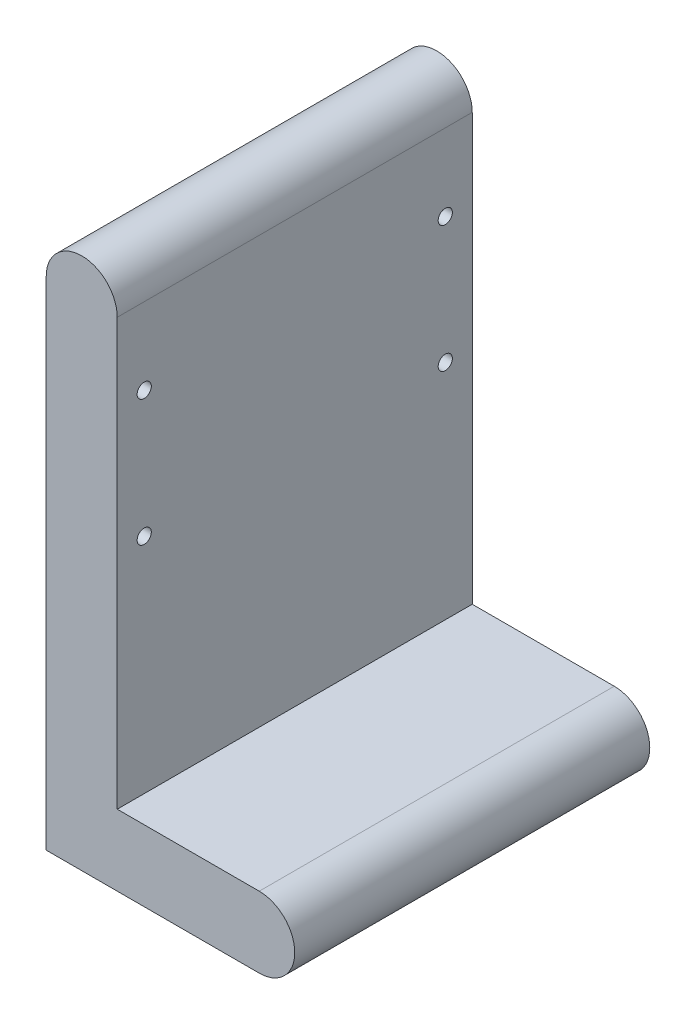
from build123d import *

# Parameters (mm, degrees)
BOSS_EXTRUDE1_DEPTH = 50
SKETCH2_R           = 1
CUT_EXTRUDE1_DEPTH  = 10


with BuildPart() as part:
    # Sketch1 → Boss-Extrude1 (new body)
    with BuildSketch(Plane.XY):
        with BuildLine():
            Line((0, 60), (0, 0))
            Line((0, 0), (20, 0))
            ThreePointArc((20, 0), (25, -5), (20, -10))
            Line((20, -10), (-10, -10))
            Line((-10, -10), (-10, 60))
            ThreePointArc((-10, 60), (-5, 65), (0, 60))
        make_face()
    extrude(amount=BOSS_EXTRUDE1_DEPTH)

    # Sketch2 → Cut-Extrude1 (cut)
    with BuildSketch(Plane.ZY.offset(10)):
        with Locations((3.8, 31.4)):
            Circle(SKETCH2_R)
        with Locations((3.8, 49.2)):
            Circle(SKETCH2_R)
        with Locations((46.2, 31.4)):
            Circle(SKETCH2_R)
        with Locations((46.2, 49.2)):
            Circle(SKETCH2_R)
    extrude(amount=-CUT_EXTRUDE1_DEPTH, mode=Mode.SUBTRACT)


solid = part.part
